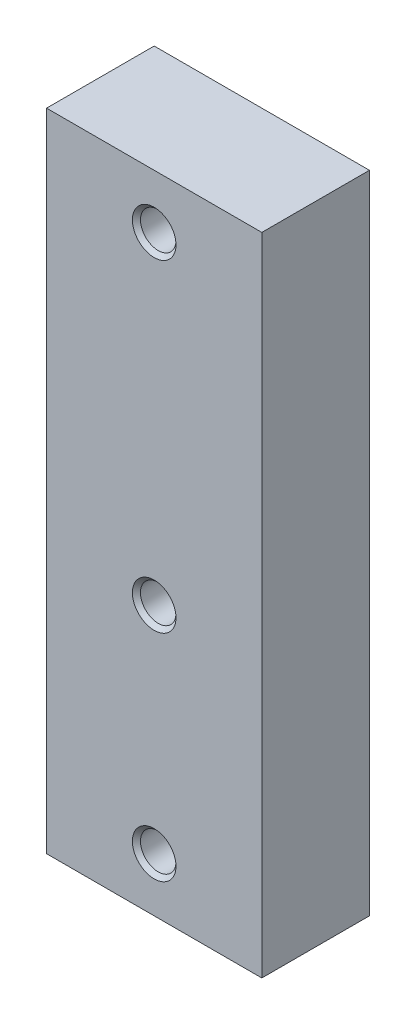
from build123d import *

# Parameters (mm, degrees)
SKIZZE1_W                          = 20
SKIZZE1_H                          = 60
AUFSATZ_LINEAR_AUSTRAGEN1_DEPTH    = 10
M4X0_7_GEWINDEBOHRUNG2_D           = 3.3
M4X0_7_GEWINDEBOHRUNG2_CSINK_D     = 4.05
M4X0_7_GEWINDEBOHRUNG2_CSINK_ANGLE = 90
M4_GEWINDEBOHRUNG1_D               = 3.3
M4_GEWINDEBOHRUNG1_DEPTH           = 30
M4_GEWINDEBOHRUNG1_TIP             = 0.991420021


with BuildPart() as part:
    # Skizze1 → Aufsatz-Linear austragen1 (new body)
    with BuildSketch(Plane.XY):
        with Locations((10, 30)):
            Rectangle(SKIZZE1_W, SKIZZE1_H)
    extrude(amount=AUFSATZ_LINEAR_AUSTRAGEN1_DEPTH)

    # M4x0.7 Gewindebohrung2 (through all)
    with Locations(Plane.XY.offset(10)):
        with Locations((10, 55), (10, 25), (10, 5)):
            CounterSinkHole(M4X0_7_GEWINDEBOHRUNG2_D / 2, M4X0_7_GEWINDEBOHRUNG2_CSINK_D / 2, counter_sink_angle=M4X0_7_GEWINDEBOHRUNG2_CSINK_ANGLE)

    # M4 Gewindebohrung1
    with Locations(Plane(origin=(0, 0, 0), x_dir=(-1, 0, 0), z_dir=(0, -1, 0))):
        with Locations((-15, -5.134624931), (-5, -5.134624931)):
            Hole(M4_GEWINDEBOHRUNG1_D / 2, depth=M4_GEWINDEBOHRUNG1_DEPTH)
            with Locations((0, 0, -(M4_GEWINDEBOHRUNG1_DEPTH + M4_GEWINDEBOHRUNG1_TIP / 2))):  # 118° drill point
                Cone(0, M4_GEWINDEBOHRUNG1_D / 2, M4_GEWINDEBOHRUNG1_TIP, mode=Mode.SUBTRACT)


solid = part.part
